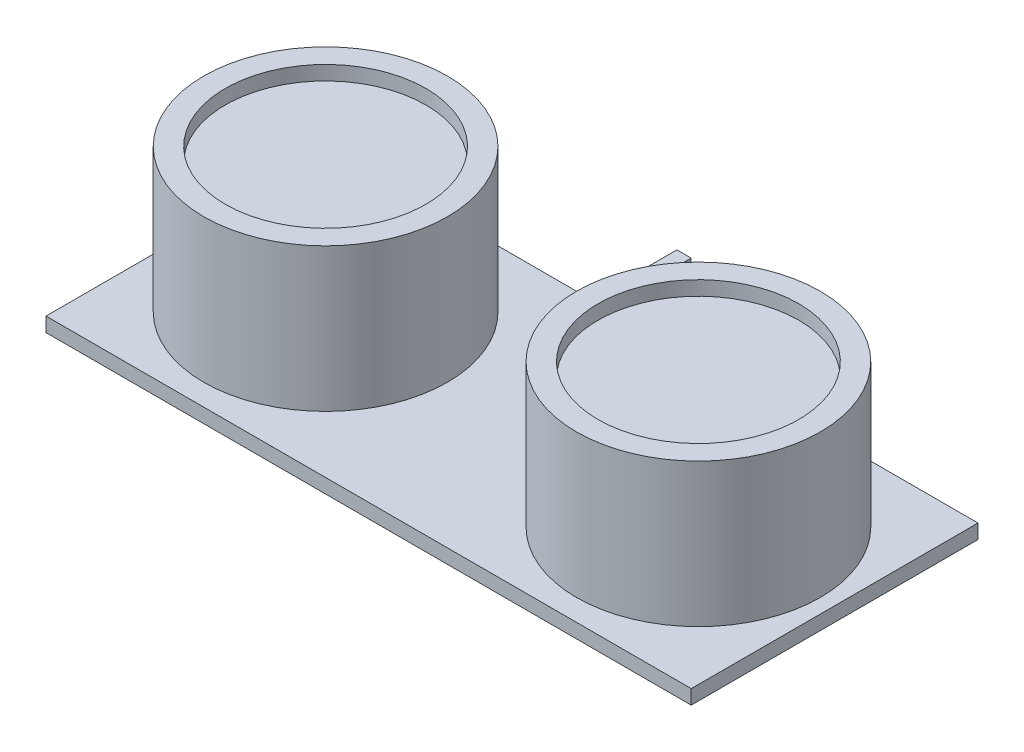
from build123d import *

# Parameters (mm, degrees)
SKETCH1_W           = 45
SKETCH1_H           = 20
BOSS_EXTRUDE1_DEPTH = 1
SKETCH2_R           = 8.5
BOSS_EXTRUDE2_DEPTH = 10
SKETCH3_R           = 7
CUT_EXTRUDE1_DEPTH  = 1
SKETCH4_W           = 1
SKETCH4_H           = 7
BOSS_EXTRUDE3_DEPTH = 1


with BuildPart() as part:
    # Sketch1 → Boss-Extrude1 (new body)
    with BuildSketch(Plane(origin=(0, 0, 0), x_dir=(1, 0, 0), z_dir=(0, 1, 0))):
        Rectangle(SKETCH1_W, SKETCH1_H)
    extrude(amount=BOSS_EXTRUDE1_DEPTH)

    # Sketch2 → Boss-Extrude2 (add)
    with BuildSketch(Plane(origin=(0, 1, 0), x_dir=(1, 0, 0), z_dir=(0, 1, 0))):
        with Locations(Location((-13, 0, 0), (0, 0, 270))):
            Circle(SKETCH2_R)
        with Locations(Location((13, 0, 0), (0, 0, 270))):
            Circle(SKETCH2_R)
    extrude(amount=BOSS_EXTRUDE2_DEPTH)

    # Sketch3 → Cut-Extrude1 (cut)
    with BuildSketch(Plane(origin=(0, 11, 0), x_dir=(1, 0, 0), z_dir=(0, 1, 0))):
        with Locations(Location((-13, 0, 0), (0, 0, 270))):
            Circle(SKETCH3_R)
        with Locations(Location((13, 0, 0), (0, 0, 270))):
            Circle(SKETCH3_R)
    extrude(amount=-CUT_EXTRUDE1_DEPTH, mode=Mode.SUBTRACT)

    # Sketch4 → Boss-Extrude3 (add)
    with BuildSketch(Plane(origin=(0, 1, 0), x_dir=(1, 0, 0), z_dir=(0, 1, 0))):
        with Locations((-1, 11.5)):
            Rectangle(SKETCH4_W, SKETCH4_H)
        with Locations((-3, 11.5)):
            Rectangle(SKETCH4_W, SKETCH4_H)
        with Locations((3, 11.5)):
            Rectangle(SKETCH4_W, SKETCH4_H)
        with Locations((1, 11.5)):
            Rectangle(SKETCH4_W, SKETCH4_H)
    extrude(amount=BOSS_EXTRUDE3_DEPTH)


solid = part.part
